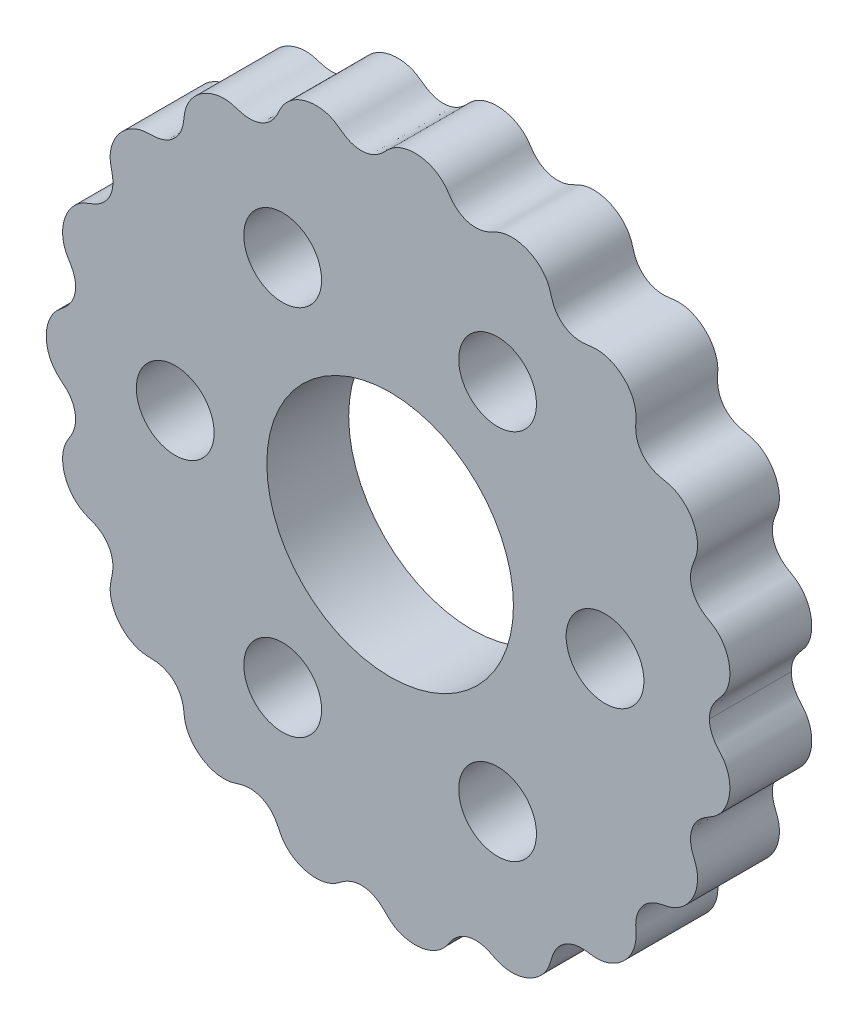
from build123d import *

# Parameters (mm, degrees)
DISC_PROFILE_DEPTH = 8
SKETCH2_R          = 12.05
SKETCH2_R_2        = 3.8
CUT_EXTRUDE2_DEPTH = 49.116236576


with BuildPart() as part:
    # Sketch1 → Disc profile (new body)
    with BuildSketch(Plane.XY):
        with BuildLine():
            add(Edge.make_bspline(
                [(-33.6, 0), (-33.6, 0.016158081), (-33.599772859, 0.048657557), (-33.598750722, 0.103075518), (-33.596024993, 0.183329597), (-33.590914188, 0.282993389), (-33.582055064, 0.396336431), (-33.567743199, 0.525112281), (-33.545925747, 0.674763671), (-33.511854758, 0.859993656), (-33.459978789, 1.079818852), (-33.383652329, 1.332405928), (-33.274286387, 1.613239716), (-33.143336952, 1.884858961), (-32.958347709, 2.198184287), (-32.703439907, 2.540796594), (-32.35647324, 2.887596766), (-31.919347585, 3.222500043), (-31.469088216, 3.641601623), (-31.065314831, 4.1903274), (-30.783294977, 4.873923502), (-30.703020534, 5.565836693), (-30.767520486, 6.149897167), (-30.909888915, 6.643606496), (-31.090792054, 7.058390852), (-31.340949031, 7.473611122), (-31.617892612, 7.912199261), (-31.800419379, 8.337265653), (-31.911372864, 8.723923014), (-31.971323201, 9.062875339), (-31.999697172, 9.346922194), (-32.008318784, 9.703969704), (-31.977434077, 10.131690696), (-31.854598792, 10.77336736), (-31.586500258, 11.45505392), (-31.1930765, 12.079106365), (-30.687941049, 12.606532972), (-30.230752361, 12.952564127), (-29.729248832, 13.213089464), (-29.205017366, 13.390569666), (-28.636998399, 13.631362706), (-28.067374701, 14.009687113), (-27.568683404, 14.552827747), (-27.2129888, 15.256181977), (-27.070311472, 15.95871288), (-27.085499992, 16.603351179), (-27.197820652, 17.176973358), (-27.325454895, 17.688827835), (-27.376533353, 18.229164047), (-27.339532835, 18.782713312), (-27.18216148, 19.478217881), (-26.821483758, 20.28483339), (-26.277117247, 20.992365245), (-25.581950708, 21.553302277), (-24.927629885, 21.889828573), (-24.383319465, 22.067246607), (-23.829492255, 22.149551525), (-23.285479697, 22.148201152), (-22.681137326, 22.188596422), (-22.030980587, 22.352575156), (-21.386550952, 22.690617239), (-20.816341241, 23.226448419), (-20.442320143, 23.837680987), (-20.236995426, 24.453667932), (-20.149964876, 25.035814174), (-20.106852548, 25.564771415), (-19.985526849, 26.097172601), (-19.774021085, 26.61412951), (-19.401836672, 27.227863191), (-18.797293621, 27.882949929), (-18.047368522, 28.383006484), (-17.199177483, 28.692326618), (-16.465769979, 28.798202596), (-15.89402955, 28.788276052), (-15.348336998, 28.686782385), (-14.842146391, 28.512628055), (-14.268521264, 28.355538925), (-13.613975473, 28.295253927), (-12.89501394, 28.395455408), (-12.167512724, 28.711356006), (-11.600050259, 29.174259194), (-11.194907941, 29.706602874), (-10.921603936, 30.239143238), (-10.707732213, 30.725918619), (-10.414088656, 31.192796003), (-10.036425592, 31.617656535), (-9.465222906, 32.083505563), (-8.667855487, 32.497397238), (-7.796802367, 32.711891332), (-6.909682484, 32.716469191), (-6.208373939, 32.579018458), (-5.68598663, 32.388537717), (-5.211809663, 32.122227904), (-4.794091564, 31.79832727), (-4.311586536, 31.46602201), (-3.724654065, 31.195363589), (-3.0222719, 31.04787211), (-2.235488714, 31.095996117), (-1.539981255, 31.33851643), (-0.967798447, 31.710235991), (-0.521806416, 32.134469924), (-0.148843316, 32.541838339), (0.291777974, 32.893876931), (0.792012189, 33.171460113), (1.477131944, 33.419808316), (2.205882775, 33.52788909), (2.937438894, 33.498254579), (3.644305596, 33.335820965), (4.179879157, 33.129952956), (4.668893647, 32.854502973), (5.099056043, 32.515640055), (5.462833826, 32.123015241), (5.752884493, 31.691307911), (6.090499587, 31.217583512), (6.548874026, 30.758211529), (7.325184012, 30.269385036), (8.248842125, 30.077521481), (9.116952105, 30.201419768), (9.855970913, 30.518179019), (10.332349037, 30.780333251), (10.99824523, 31.046252705), (11.883774436, 31.173992895), (12.941842185, 31.045958583), (13.930685619, 30.611953924), (14.65757282, 30.051632065), (15.140666756, 29.484862858), (15.441191961, 28.988211791), (15.64559711, 28.458952778), (15.776406727, 27.922706406), (15.98235336, 27.341697573), (16.326364212, 26.751791078), (16.840815384, 26.223927869), (17.522914273, 25.829420294), (18.216590534, 25.647611029), (18.861553525, 25.624643815), (19.441766069, 25.700366812), (19.964868711, 25.778647404), (20.505149784, 25.770616091), (21.044985218, 25.677798178), (21.573539769, 25.500566134), (22.078399189, 25.24616753), (22.681690336, 24.828370122), (23.2071326, 24.293227631), (23.628033924, 23.654463422), (23.899914007, 22.952571211), (24.018239119, 22.388008015), (24.037161119, 21.833396778), (23.990133839, 21.30406883), (23.99213124, 20.704535709), (24.114401775, 20.046007136), (24.413963669, 19.38152897), (24.916977616, 18.779619649), (25.50356592, 18.371718686), (26.09975486, 18.130178058), (26.669355719, 18.004952465), (27.188060869, 17.915378287), (27.701623448, 17.743352867), (28.191767483, 17.486207942), (28.763064263, 17.062119825), (29.3550959, 16.407172569), (29.782890524, 15.623662493), (30.015848255, 14.760590609), (30.05931291, 14.024519075), (30.00130851, 13.453672629), (29.851636864, 12.912956213), (29.630701877, 12.414584662), (29.426687878, 11.842800764), (29.318735727, 11.179526721), (29.373937375, 10.453131138), (29.640178387, 9.717409635), (30.052763024, 9.132522934), (30.535389007, 8.700417226), (31.033560322, 8.389464878), (31.499320908, 8.137315886), (31.935909945, 7.811181514), (32.322270668, 7.409575168), (32.732328991, 6.822358745), (33.026109075, 6.14676365), (33.188955019, 5.4237959), (33.213314987, 4.681429915), (33.144689653, 4.083451419), (32.989654113, 3.519648008), (32.75454088, 3.003210105), (32.484366012, 2.60228204), (32.223547356, 2.301685267), (32.005976963, 2.051851663), (31.840266336, 1.844633219), (31.697667995, 1.640903452), (31.578221369, 1.441929959), (31.480251272, 1.250102477), (31.401387735, 1.067702346), (31.33471948, 0.880342159), (31.287518108, 0.713187137), (31.255268561, 0.567285678), (31.233961249, 0.445086252), (31.22028716, 0.347944059), (31.210009798, 0.249228588), (31.20314781, 0.143305505), (31.20057226, 0.064258301), (31.2, 0.021313778), (31.2, 0)],
                knots=[0.071290042, 0.071290042, 0.071290042, 0.071290042, 0.071290042, 0.071851353, 0.072412665, 0.072973976, 0.073535288, 0.074657911, 0.075780534, 0.076903158, 0.078025781, 0.080271027, 0.082516273, 0.08476152, 0.087006766, 0.089252013, 0.093356984, 0.097461956, 0.101566928, 0.1056719, 0.111645692, 0.117619485, 0.12333387, 0.126191063, 0.129048256, 0.132912106, 0.136775957, 0.140639808, 0.144503659, 0.146631242, 0.148758825, 0.150886408, 0.153013991, 0.157269156, 0.161524322, 0.170305863, 0.174696633, 0.179087404, 0.183211223, 0.187335042, 0.191458861, 0.195582681, 0.201571057, 0.207559434, 0.213175135, 0.218790837, 0.222721439, 0.226652041, 0.230582643, 0.234513246, 0.238824576, 0.243135907, 0.251758568, 0.26065471, 0.265102781, 0.269550852, 0.273604634, 0.277658416, 0.281712198, 0.28576598, 0.291632176, 0.297498372, 0.303155155, 0.308811938, 0.312766873, 0.316721809, 0.320676744, 0.32463168, 0.328971955, 0.33331223, 0.341992779, 0.350998085, 0.355500737, 0.36000339, 0.363992223, 0.367981057, 0.371969891, 0.375958725, 0.381697805, 0.387436885, 0.393373368, 0.399309852, 0.403271636, 0.407233419, 0.411195203, 0.415156986, 0.419637287, 0.424117589, 0.433078192, 0.441720168, 0.446041156, 0.450362144, 0.454300787, 0.458239429, 0.462178071, 0.466116714, 0.471746192, 0.477375671, 0.483351187, 0.489326704, 0.493441787, 0.497556869, 0.501671951, 0.505787034, 0.510168385, 0.514549736, 0.523312439, 0.527577038, 0.531841637, 0.536106235, 0.540370834, 0.544243546, 0.548116257, 0.551988969, 0.55586168, 0.561588458, 0.567315235, 0.579077299, 0.58312977, 0.587182242, 0.591234713, 0.595287185, 0.604416933, 0.613546681, 0.622546492, 0.627046398, 0.631546304, 0.635660308, 0.639774312, 0.643888315, 0.648002319, 0.653988115, 0.65997391, 0.665590561, 0.671207212, 0.675146961, 0.679086709, 0.683026458, 0.686966207, 0.691169885, 0.695373563, 0.699577242, 0.70378092, 0.712975837, 0.717573295, 0.722170754, 0.726131814, 0.730092874, 0.734053935, 0.738014995, 0.743964647, 0.7499143, 0.755517261, 0.761120222, 0.76504231, 0.768964397, 0.772886485, 0.776808572, 0.781110228, 0.785411884, 0.794015196, 0.802930422, 0.807388035, 0.811845648, 0.815908047, 0.819970446, 0.824032845, 0.828095245, 0.83397437, 0.839853495, 0.845496667, 0.851139839, 0.855086604, 0.85903337, 0.862980135, 0.866926901, 0.871257527, 0.875588153, 0.884249406, 0.888720052, 0.893190699, 0.897661345, 0.902131991, 0.906085375, 0.910038759, 0.912015451, 0.913992143, 0.915968835, 0.917945527, 0.919426355, 0.920907183, 0.922388012, 0.92386884, 0.925349668, 0.926090082, 0.926830496, 0.92757091, 0.928311324, 0.929051738, 0.929792152, 0.929792152, 0.929792152, 0.929792152, 0.929792152], degree=4))
            add(Edge.make_bspline(
                [(31.2, 0), (31.2, -0.021313778), (31.200572458, -0.064180752), (31.203148035, -0.139304343), (31.210009861, -0.246269473), (31.222856453, -0.373954875), (31.245065996, -0.51853113), (31.280774999, -0.688890065), (31.334719564, -0.880559093), (31.401387528, -1.067618361), (31.480251612, -1.250130661), (31.578220526, -1.441920802), (31.697669537, -1.640903507), (31.840262542, -1.84464102), (32.005982887, -2.051838393), (32.223546254, -2.301693339), (32.484362393, -2.602281941), (32.754544189, -3.003208895), (32.989652083, -3.519648658), (33.144691126, -4.083451174), (33.213314068, -4.681429635), (33.18895591, -5.42379686), (33.02610813, -6.146761773), (32.732330051, -6.822361572), (32.322269578, -7.409571888), (31.935912015, -7.811187662), (31.499317433, -8.137306288), (31.03356348, -8.38947311), (30.535387643, -8.700413361), (30.052763444, -9.132525103), (29.640178644, -9.717408048), (29.373936404, -10.453132565), (29.318737671, -11.179525116), (29.426684163, -11.842803197), (29.630709474, -12.414579902), (29.851628357, -12.912961845), (30.00131351, -13.453668971), (30.059310453, -14.024521201), (30.015850198, -14.760588502), (29.782888964, -15.623664995), (29.355096923, -16.407169717), (28.763063713, -17.062122844), (28.191767801, -17.486204377), (27.701623268, -17.743359464), (27.188060767, -17.915368282), (26.66935596, -18.004960494), (26.099754953, -18.130174709), (25.503565426, -18.371720341), (24.916978648, -18.779618547), (24.413961887, -19.381529856), (24.114404688, -20.046006264), (23.992126332, -20.704536872), (23.990142669, -21.304066793), (24.037152247, -21.833399037), (24.018243978, -22.388006657), (23.899911782, -22.952571772), (23.628035675, -23.654463271), (23.207131658, -24.293227149), (22.681690528, -24.828371272), (22.078399533, -25.246165814), (21.573538784, -25.500569333), (21.044986668, -25.677793763), (20.50514769, -25.770622657), (19.964871195, -25.778638969), (19.441764499, -25.700372675), (18.861554094, -25.624642248), (18.216589928, -25.647611346), (17.522915354, -25.829420303), (16.840813579, -26.223927655), (16.326367146, -26.751791491), (15.982348426, -27.341696913), (15.776415634, -27.92270744), (15.645587928, -28.458951955), (15.441196684, -28.988212111), (15.140664853, -29.484862642), (14.657573922, -30.051632508), (13.930685355, -30.61195304), (12.941841526, -31.0459602), (11.883775957, -31.173990662), (10.998242946, -31.046255763), (10.332352603, -30.780328399), (9.855967605, -30.518183835), (9.116954502, -30.201415972), (8.248840608, -30.077524319), (7.325184791, -30.269382907), (6.54887391, -30.758213035), (6.090498295, -31.217581401), (5.752889976, -31.691311979), (5.462825904, -32.123010522), (5.099062078, -32.515643454), (4.66888975, -32.854500712), (4.179881785, -33.129954689), (3.644304472, -33.33581978), (2.937439084, -33.498255866), (2.205883753, -33.527887582), (1.477129835, -33.419810095), (0.792014855, -33.171458237), (0.291772839, -32.893880391), (-0.148835265, -32.541832746), (-0.521813212, -32.134474826), (-0.967795173, -31.7102337), (-1.539983186, -31.338517493), (-2.235487265, -31.095995819), (-3.022273236, -31.047871746), (-3.724652472, -31.195364741), (-4.311589291, -31.466019369), (-4.794085498, -31.798333284), (-5.211817049, -32.122220975), (-5.68598171, -32.388541965), (-6.208376706, -32.579016381), (-6.909679949, -32.716470722), (-7.796805131, -32.711890269), (-8.667852577, -32.497397677), (-9.465225818, -32.083505657), (-10.036422333, -31.61765609), (-10.414094599, -31.192797267), (-10.707723288, -30.725916308), (-10.921611736, -30.239145501), (-11.194904298, -29.706601886), (-11.600052281, -29.17425947), (-12.167511333, -28.711356286), (-12.895015067, -28.395454535), (-13.613974314, -28.295255642), (-14.268523047, -28.355535468), (-14.842142671, -28.512635525), (-15.348341444, -28.686774053), (-15.894026451, -28.788281317), (-16.465771832, -28.798199893), (-17.199175648, -28.692328765), (-18.047370704, -28.383004688), (-18.797291116, -27.882951223), (-19.401839349, -27.227862358), (-19.774017863, -26.614130163), (-19.985533118, -26.097171795), (-20.106842445, -25.564772271), (-20.149973831, -25.035813646), (-20.236991152, -24.453668281), (-20.44232244, -23.837680497), (-20.816339803, -23.226449257), (-21.386551915, -22.690615854), (-22.030979888, -22.352577452), (-22.681138041, -22.188592206), (-23.285478435, -22.148209889), (-23.829493959, -22.149541422), (-24.38331814, -22.067252775), (-24.927630836, -21.889825371), (-25.581949575, -21.553304985), (-26.277118883, -20.99236275), (-26.821481597, -20.284835505), (-27.18216398, -19.478216162), (-27.339529745, -18.782715022), (-27.37653929, -18.229161253), (-27.325445613, -17.68883176), (-27.197828374, -17.176970337), (-27.085496696, -16.603352552), (-27.070312993, -15.958711925), (-27.212988052, -15.256183062), (-27.568683624, -14.552826244), (-28.067374965, -14.00968942), (-28.636997567, -13.631358641), (-29.205019148, -13.39057797), (-29.729246956, -13.213079932), (-30.230753465, -12.952570029), (-30.687940361, -12.606530002), (-31.193077413, -12.079108655), (-31.586498948, -11.455053003), (-31.854600681, -10.773366762), (-31.977431758, -10.131692592), (-32.008322673, -9.703965657), (-31.999692002, -9.346927867), (-31.971329825, -9.062868208), (-31.911364678, -8.723931457), (-31.800430132, -8.337255377), (-31.617879945, -7.912210314), (-31.340957534, -7.473604744), (-31.09079002, -7.058391402), (-30.909889106, -6.643607285), (-30.76752035, -6.149896236), (-30.703020876, -5.565837946), (-30.783294236, -4.873921763), (-31.065315991, -4.190329619), (-31.469086278, -3.641598186), (-31.919350955, -3.222506039), (-32.356470804, -2.887592166), (-32.703438522, -2.540793639), (-32.958351605, -2.198194036), (-33.14333163, -1.884841553), (-33.274293948, -1.613276291), (-33.383642176, -1.332325738), (-33.45998854, -1.079938676), (-33.511847651, -0.859939414), (-33.545929496, -0.674303925), (-33.567742109, -0.526440821), (-33.582054828, -0.397309686), (-33.590914224, -0.279724395), (-33.597047244, -0.158868263), (-33.599318594, -0.08070749), (-33.6, -0.032316163), (-33.6, 0)],
                knots=[0.070207848, 0.070207848, 0.070207848, 0.070207848, 0.070207848, 0.070948262, 0.071688676, 0.07242909, 0.073169504, 0.074650332, 0.07613116, 0.077611988, 0.079092817, 0.080573645, 0.082054473, 0.084031165, 0.086007857, 0.087984549, 0.089961241, 0.093914625, 0.097868009, 0.102338655, 0.106809301, 0.111279948, 0.115750594, 0.124411847, 0.128742473, 0.133073099, 0.137019865, 0.14096663, 0.144913396, 0.148860161, 0.154503333, 0.160146505, 0.16602563, 0.171904755, 0.175967155, 0.180029554, 0.184091953, 0.188154352, 0.192611965, 0.197069578, 0.205984804, 0.214588116, 0.218889772, 0.223191428, 0.227113515, 0.231035603, 0.23495769, 0.238879778, 0.244482739, 0.2500857, 0.256035353, 0.261985005, 0.265946065, 0.269907126, 0.273868186, 0.277829246, 0.282426705, 0.287024163, 0.29621908, 0.300422758, 0.304626437, 0.308830115, 0.313033793, 0.316973542, 0.320913291, 0.324853039, 0.328792788, 0.334409439, 0.34002609, 0.346011885, 0.351997681, 0.356111685, 0.360225688, 0.364339692, 0.368453696, 0.372953602, 0.377453508, 0.386453319, 0.395583067, 0.404712815, 0.408765287, 0.412817758, 0.41687023, 0.420922701, 0.432684765, 0.438411542, 0.44413832, 0.448011031, 0.451883743, 0.455756454, 0.459629166, 0.463893765, 0.468158363, 0.472422962, 0.476687561, 0.485450264, 0.489831615, 0.494212966, 0.498328049, 0.502443131, 0.506558213, 0.510673296, 0.516648813, 0.522624329, 0.528253808, 0.533883286, 0.537821929, 0.541760571, 0.545699213, 0.549637856, 0.553958844, 0.558279832, 0.566921808, 0.575882411, 0.580362713, 0.584843014, 0.588804797, 0.592766581, 0.596728364, 0.600690148, 0.606626632, 0.612563115, 0.618302195, 0.624041275, 0.628030109, 0.632018943, 0.636007777, 0.63999661, 0.644499263, 0.649001915, 0.658007221, 0.66668777, 0.671028045, 0.67536832, 0.679323256, 0.683278191, 0.687233127, 0.691188062, 0.696844845, 0.702501628, 0.708367824, 0.71423402, 0.718287802, 0.722341584, 0.726395366, 0.730449148, 0.734897219, 0.73934529, 0.748241432, 0.756864093, 0.761175424, 0.765486754, 0.769417357, 0.773347959, 0.777278561, 0.781209163, 0.786824865, 0.792440566, 0.798428943, 0.804417319, 0.808541139, 0.812664958, 0.816788777, 0.820912596, 0.825303367, 0.829694137, 0.838475678, 0.842730844, 0.846986009, 0.849113592, 0.851241175, 0.853368758, 0.855496341, 0.859360192, 0.863224043, 0.867087894, 0.870951744, 0.873808937, 0.87666613, 0.882380515, 0.888354308, 0.8943281, 0.898433072, 0.902538044, 0.906643016, 0.910747987, 0.912993234, 0.91523848, 0.917483727, 0.919728973, 0.921974219, 0.923096842, 0.924219466, 0.925342089, 0.926464712, 0.927026024, 0.927587335, 0.928709958, 0.928709958, 0.928709958, 0.928709958, 0.928709958], degree=4))
        make_face()
    extrude(amount=DISC_PROFILE_DEPTH)

    # Sketch2 → Cut-Extrude2 (cut, through all)
    with BuildSketch(Plane.XY.offset(8)):
        Circle(SKETCH2_R)
        with Locations((-21, 0)):
            Circle(SKETCH2_R_2)
        with Locations((-10.5, 18.186533479)):
            Circle(SKETCH2_R_2)
        with Locations((10.5, 18.186533479)):
            Circle(SKETCH2_R_2)
        with Locations((21, 0)):
            Circle(SKETCH2_R_2)
        with Locations((10.5, -18.186533479)):
            Circle(SKETCH2_R_2)
        with Locations((-10.5, -18.186533479)):
            Circle(SKETCH2_R_2)
    extrude(amount=-CUT_EXTRUDE2_DEPTH, mode=Mode.SUBTRACT)


solid = part.part
